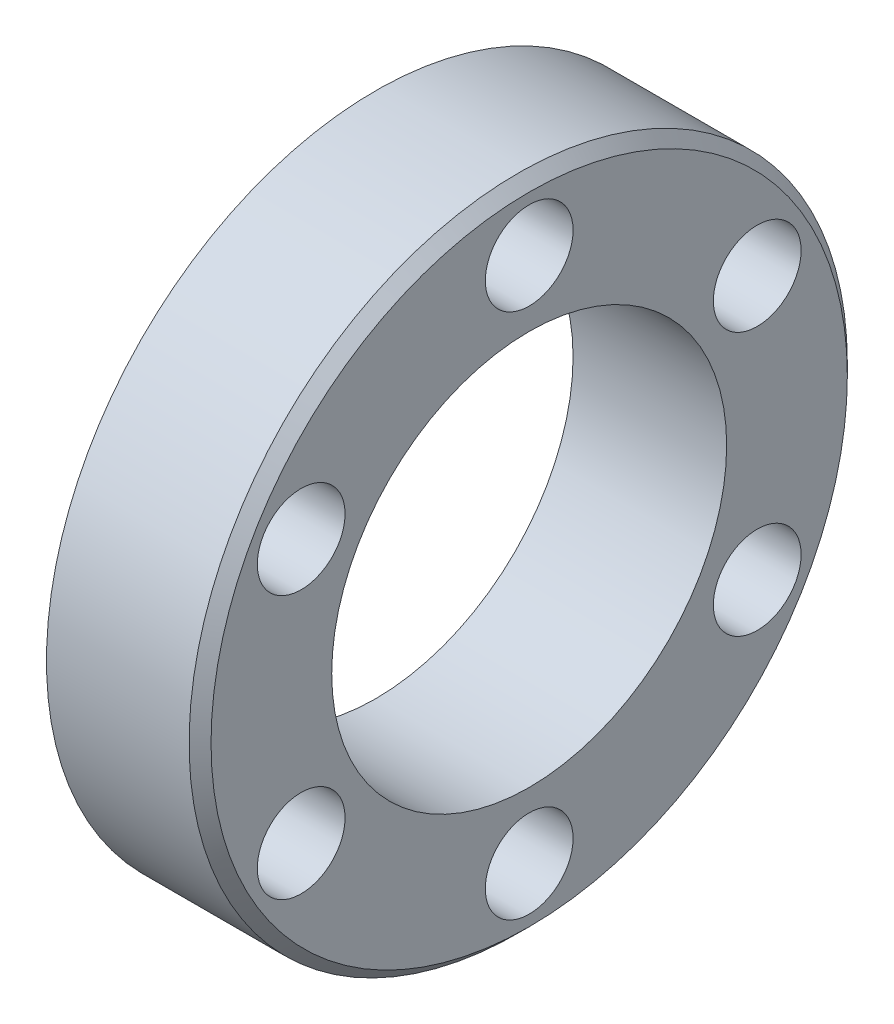
from build123d import *

# Parameters (mm, degrees)
SKETCH1_R           = 15
SKETCH1_R_2         = 9
BOSS_EXTRUDE1_DEPTH = 7
CIRPATTERN1_COUNT   = 6
CHAMFER1_SIZE       = 0.5


with BuildPart() as part:
    # Sketch1 → Boss-Extrude1 (new body)
    with BuildSketch(Plane(origin=(0, 0, 0), x_dir=(0, 0, -1), z_dir=(1, 0, 0))):
        Circle(SKETCH1_R)
        Circle(SKETCH1_R_2, mode=Mode.SUBTRACT)
    extrude(amount=BOSS_EXTRUDE1_DEPTH)

    # Sketch3 → Ø4.0mm Dowel Hole1 (revolve, cut)
    with BuildSketch(Plane(origin=(7, 12, 0), x_dir=(0, 0, -1), z_dir=(0, 1, 0))):
        Polygon((0, 0), (0, 51.201721238), (2, 50), (2, 0), align=None)
    f_4_0mm_dowel_hole1 = revolve(axis=Axis((13.35, 12, 0), (-1, 0, 0)), mode=Mode.SUBTRACT)

    # CirPattern1: Ø4.0mm Dowel Hole1 ×6 about axis
    cirpattern1_axis = Axis((0, 0, 0), (1, 0, 0))
    for i in range(1, CIRPATTERN1_COUNT):
        add(f_4_0mm_dowel_hole1.rotate(cirpattern1_axis, i * 360 / CIRPATTERN1_COUNT), mode=Mode.SUBTRACT)

    # Chamfer1
    chamfer1_edges = [part.edges().sort_by_distance(p)[0] for p in [
        (7, 0, 15),
    ]]
    chamfer(chamfer1_edges, length=CHAMFER1_SIZE)


solid = part.part
